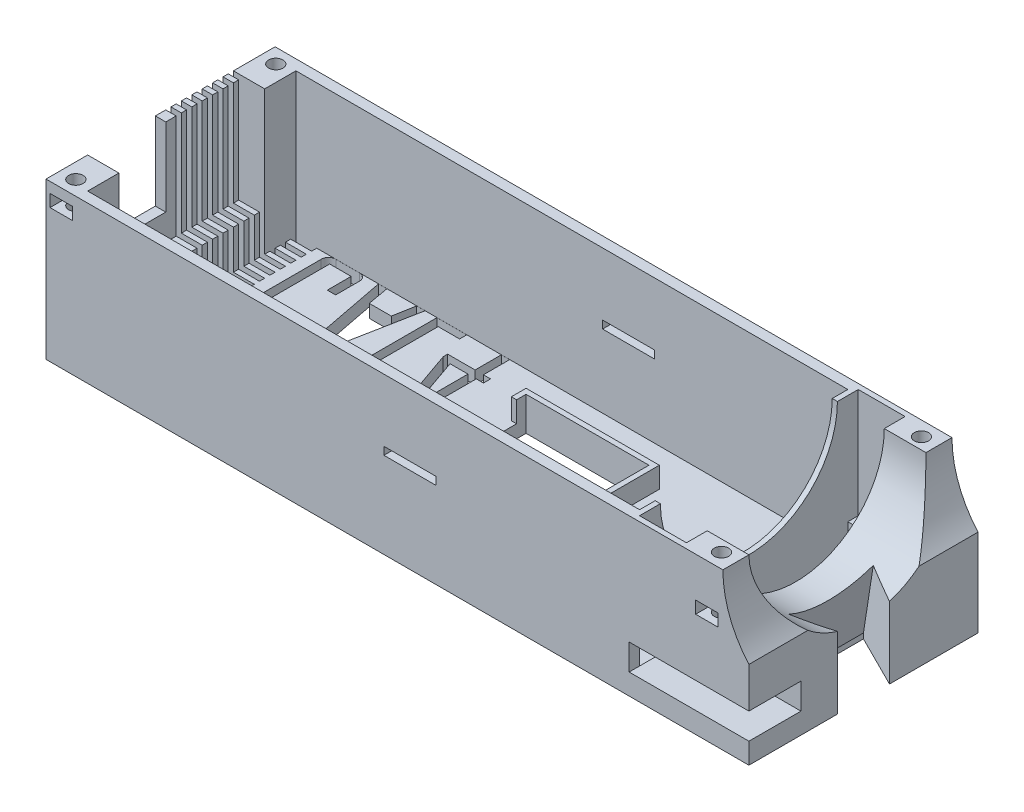
from build123d import *

# Parameters (mm, degrees)
SKETCH3_W               = 520.7
SKETCH3_H               = 111.76
BOSS_EXTRUDE1_DEPTH     = 73.66
SKETCH4_R               = 50.8
CUT_EXTRUDE2_DEPTH      = 156.718
SKETCH2_W               = 6.604
SKETCH2_H               = 8.636
SKETCH2_W_2             = 71.755
SKETCH2_H_2             = 71.755
SKETCH2_R               = 29.21
SKETCH2_R_2             = 20.32
CUT_EXTRUDE5_DEPTH      = 96.52
BOSS_EXTRUDE2_DEPTH     = 96.52
SKETCH5_R               = 43.18
CUT_EXTRUDE3_DEPTH      = 304.8
SKETCH6_W               = 279.4
SKETCH6_H               = 101.6
CUT_EXTRUDE4_DEPTH      = 50.8
BOSS_EXTRUDE3_DEPTH     = 2.54
SKETCH10_W              = 2.54
SKETCH10_H              = 101.6
SKETCH10_W_2            = 45.389856448
SKETCH10_H_2            = 38.1
CUT_EXTRUDE6_DEPTH      = 25.4
CUT_EXTRUDE7_DEPTH      = 50.8
BOSS_EXTRUDE4_START     = -76.2
SKETCH13_W              = 15.24
SKETCH13_H              = 20.32
BOSS_EXTRUDE4_DEPTH     = 76.2
SKETCH14_W              = 11
SKETCH14_H              = 6
CUT_EXTRUDE8_DEPTH      = 14
CUT_EXTRUDE9_DEPTH      = 406.4
CUT_EXTRUDE9_DEPTH_BACK = 5.08
SKETCH15_R              = 3.5
CUT_EXTRUDE10_START     = -111.76
SKETCH14_2_W            = 11
SKETCH14_2_H            = 6
CUT_EXTRUDE10_DEPTH     = 14
SKETCH18_W              = 269.24
SKETCH18_H              = 101.6
CUT_EXTRUDE12_DEPTH     = 19.05
CUT_EXTRUDE13_DEPTH     = 20.32
SKETCH20_W              = 59.944
SKETCH20_H              = 59.944
CUT_EXTRUDE14_DEPTH     = 73
SKETCH21_W              = 65.024
SKETCH21_H              = 65.024
SKETCH21_W_2            = 59.944
SKETCH21_H_2            = 59.944
BOSS_EXTRUDE5_DEPTH     = 10.16
SKETCH22_W              = 20.87594444
SKETCH22_H              = 50.707929828
CUT_EXTRUDE15_DEPTH     = 10.16
SKETCH23_W              = 25.4
SKETCH23_H              = 3.81
CUT_EXTRUDE16_DEPTH     = 187.96
SKETCH24_W              = 35.579541651
SKETCH24_H              = 12.7
CUT_EXTRUDE17_DEPTH     = 58.42
SKETCH25_W              = 22.86
SKETCH25_H              = 106.68
CUT_EXTRUDE18_DEPTH     = 53.34
SKETCH26_W              = 22.86
SKETCH26_H              = 25.4
CUT_EXTRUDE19_DEPTH     = 52.54
SKETCH27_W              = 22.86
SKETCH27_H              = 73.66
CUT_EXTRUDE20_DEPTH     = 15.24


with BuildPart() as part:
    # Sketch3 → Boss-Extrude1 (new body)
    with BuildSketch(Plane(origin=(0, 0, 0), x_dir=(1, 0, 0), z_dir=(0, 1, 0))):
        with Locations((209.55, 36.195)):
            Rectangle(SKETCH3_W, SKETCH3_H)
    extrude(amount=BOSS_EXTRUDE1_DEPTH)

    # Sketch4 → Cut-Extrude2 (cut)
    with BuildSketch(Plane.XY.offset(19.685)):
        with Locations((330.2, 73.66)):
            Circle(SKETCH4_R)
        Polygon((469.9, 22.86), (330.2, 22.86), (279.4, 73.66), (469.9, 73.66), align=None)
    extrude(amount=-CUT_EXTRUDE2_DEPTH, mode=Mode.SUBTRACT)

    # Sketch2 → Cut-Extrude5 (cut)
    # profile 1 of 9: a face of its own
    with BuildSketch(Plane(origin=(0, 0, 0), x_dir=(1, 0, 0), z_dir=(0, 1, 0))):
        Polygon((266.7, 10.795), (292.1, 23.495), (292.1, 48.895), (266.7, 61.595), align=None)
    # profile 2 of 9: a face of its own
    with BuildSketch(Plane(origin=(0, 0, 0), x_dir=(1, 0, 0), z_dir=(0, 1, 0))):
        Polygon((292.1, -19.685), (469.9, -19.685), (469.9, 92.075), (292.1, 92.075), (292.1, 48.895), (292.1, 23.495), align=None)
        Polygon((451.485, 74.93), (451.485, -2.54), (374.015, -2.54), (374.015, -0.635), (317.5, -0.635), (317.5, 48.895), (313.944, 48.895), (313.944, 68.453), (307.34, 68.453), (307.34, 77.089), (313.944, 77.089), (317.5, 77.089), (317.5, 89.789), (449.58, 89.789), (449.58, 74.93), align=None, mode=Mode.SUBTRACT)
    # profile 3 of 9: a face of its own
    with BuildSketch(Plane(origin=(0, 0, 0), x_dir=(1, 0, 0), z_dir=(0, 1, 0))):
        Polygon((326.263, 3.175), (374.015, 3.175), (374.015, 74.93), (445.77, 74.93), (445.77, 85.979), (326.263, 85.979), (326.263, 77.089), (326.263, 48.895), align=None)
    # profile 4 of 9: a face of its own
    with BuildSketch(Plane(origin=(0, 0, 0), x_dir=(1, 0, 0), z_dir=(0, 1, 0))):
        Polygon((317.5, -0.635), (374.015, -0.635), (374.015, 3.175), (326.263, 3.175), (326.263, 48.895), (317.5, 48.895), align=None)
    # profile 5 of 9: a face of its own
    with BuildSketch(Plane(origin=(0, 0, 0), x_dir=(1, 0, 0), z_dir=(0, 1, 0))):
        with Locations((310.642, 72.771)):
            Rectangle(SKETCH2_W, SKETCH2_H)
    # profile 6 of 9: a face of its own
    with BuildSketch(Plane(origin=(0, 0, 0), x_dir=(1, 0, 0), z_dir=(0, 1, 0))):
        Polygon((445.77, 74.93), (449.58, 74.93), (449.58, 89.789), (317.5, 89.789), (317.5, 77.089), (326.263, 77.089), (326.263, 85.979), (445.77, 85.979), align=None)
    # profile 7 of 9: a face of its own
    with BuildSketch(Plane(origin=(0, 0, 0), x_dir=(1, 0, 0), z_dir=(0, 1, 0))):
        with Locations((409.8925, 39.0525)):
            Rectangle(SKETCH2_W_2, SKETCH2_H_2)
        with Locations((412.75, 36.195)):
            Circle(SKETCH2_R, mode=Mode.SUBTRACT)
    # profile 8 of 9: a face of its own
    with BuildSketch(Plane(origin=(0, 0, 0), x_dir=(1, 0, 0), z_dir=(0, 1, 0))):
        with Locations((412.75, 36.195)):
            Circle(SKETCH2_R)
        with Locations((412.75, 36.195)):
            Circle(SKETCH2_R_2, mode=Mode.SUBTRACT)
    # profile 9 of 9: a face of its own
    with BuildSketch(Plane(origin=(0, 0, 0), x_dir=(1, 0, 0), z_dir=(0, 1, 0))):
        with Locations((412.75, 36.195)):
            Circle(SKETCH2_R_2)
    extrude(amount=CUT_EXTRUDE5_DEPTH, mode=Mode.SUBTRACT)


with BuildPart() as cut_extrude5_kept_piece:
    # of the separate pieces the step leaves, the one the design keeps (cut_extrude5_pieces_kept)
    add(part.part.solids().sort_by_distance((-50.8, 0, -92.075))[0])

    # Sketch8 → Boss-Extrude2 (add)
    with BuildSketch(Plane(origin=(0, 0, -92.075), x_dir=(-1, 0, 0), z_dir=(0, 0, -1))):
        Polygon((-266.7, 0), (-280.811202491, 52.663724651), (-120.77367767, 52.663724651), (-106.383256095, 52.663724651), (-106.383256095, 0), align=None)
    extrude(amount=-BOSS_EXTRUDE2_DEPTH)

    # Sketch5 → Cut-Extrude3 (cut)
    with BuildSketch(Plane(origin=(0, 0, 0), x_dir=(0, 0, -1), z_dir=(1, 0, 0))):
        with Locations((36.195, 73.66)):
            Circle(SKETCH5_R)
    extrude(amount=CUT_EXTRUDE3_DEPTH, mode=Mode.SUBTRACT)

    # Sketch6 → Cut-Extrude4 (cut)
    with BuildSketch(Plane(origin=(0, 73.66, 0), x_dir=(1, 0, 0), z_dir=(0, 1, 0))):
        with Locations((93.98, 36.195)):
            Rectangle(SKETCH6_W, SKETCH6_H)
    extrude(amount=-CUT_EXTRUDE4_DEPTH, mode=Mode.SUBTRACT)

    # Sketch7 → Cut-Revolve1 (revolve, cut)
    with BuildSketch(Plane(origin=(0, 73.66, 0), x_dir=(1, 0, 0), z_dir=(0, 1, 0))):
        with BuildLine():
            Line((241.3, -13.805), (245.161436971, -13.805))
            ThreePointArc((245.161436971, -13.805), (245.979341863, -10.401680901), (246.739500346, -6.985))
            Line((246.739500346, -6.985), (241.3, -6.985))
            Line((241.3, -6.985), (241.3, -13.805))
        make_face()
    revolve(axis=Axis((-45.72, 73.66, -36.195), (1, 0, 0)), mode=Mode.SUBTRACT)

    # Sketch2<11> → Boss-Extrude3 (add)
    with BuildSketch(Plane(origin=(0, 0, 0), x_dir=(1, 0, 0), z_dir=(0, 1, 0))):
        Polygon((-50.8, -19.685), (292.1, -19.685), (292.1, 23.495), (266.7, 10.795), (266.7, 61.595), (292.1, 48.895), (292.1, 92.075), (-50.8, 92.075), align=None)
    extrude(amount=-BOSS_EXTRUDE3_DEPTH)

    # Sketch10 → Cut-Extrude6 (cut)
    with BuildSketch(Plane.ZY.offset(50.8)):
        with Locations((-85.725, 35.56)):
            Rectangle(SKETCH10_W, SKETCH10_H)
        with Locations((-80.645, 35.56)):
            Rectangle(SKETCH10_W, SKETCH10_H)
        with Locations((-75.565, 35.56)):
            Rectangle(SKETCH10_W, SKETCH10_H)
        with Locations((-70.485, 35.56)):
            Rectangle(SKETCH10_W, SKETCH10_H)
        with Locations((-65.405, 35.56)):
            Rectangle(SKETCH10_W, SKETCH10_H)
        with Locations((-60.325, 35.56)):
            Rectangle(SKETCH10_W, SKETCH10_H)
        with Locations((-55.245, 35.56)):
            Rectangle(SKETCH10_W, SKETCH10_H)
        with Locations((-50.165, 35.56)):
            Rectangle(SKETCH10_W, SKETCH10_H)
        with Locations((-45.085, 35.56)):
            Rectangle(SKETCH10_W, SKETCH10_H)
        with Locations((-40.005, 35.56)):
            Rectangle(SKETCH10_W, SKETCH10_H)
        with Locations((-10.960071776, 54.61)):
            Rectangle(SKETCH10_W_2, SKETCH10_H_2)
    extrude(amount=-CUT_EXTRUDE6_DEPTH, mode=Mode.SUBTRACT)

    # Sketch11 → Cut-Extrude7 (cut)
    # profile 1 of 4: a face of its own
    with BuildSketch(Plane.XZ.offset(2.54)):
        with BuildLine():
            add(Edge.make_bspline(
                [(-1.033440652, -83.401170176), (-1.044005945, -83.654086912), (-1.064328213, -84.140570497), (-1.26755091, -84.829712357), (-1.575162908, -85.455903617), (-2.026585814, -85.985342425), (-2.561110938, -86.428572002), (-3.182622877, -86.740493137), (-3.869425011, -86.926834798), (-4.348309719, -86.950397605), (-4.594796073, -86.962525598)],
                knots=[0, 0, 0, 0, 1.072704838, 2.063340312, 3.030938541, 4.018639787, 4.998163091, 5.96576132, 6.952958679, 8, 8, 8, 8], degree=3))
            Line((-4.594796073, -86.962525598), (-16.07835029, -86.962525598))
            add(Edge.make_bspline(
                [(-16.07835029, -86.962525598), (-16.330932611, -86.950853548), (-16.815963405, -86.928439851), (-17.508859338, -86.740607294), (-18.129603023, -86.428109412), (-18.665521101, -85.988340987), (-19.105289526, -85.45242291), (-19.417787408, -84.831679225), (-19.605619965, -84.138783291), (-19.628033662, -83.653752498), (-19.639705712, -83.401170176)],
                knots=[0, 0, 0, 0, 1.070824542, 2.056291488, 3.022193657, 4, 4.977806343, 5.943708512, 6.929175458, 8, 8, 8, 8], degree=3))
            Line((-19.639705712, -83.401170176), (-19.639705712, -42.26388102))
            add(Edge.make_bspline(
                [(-19.639705712, -42.26388102), (-19.628076161, -42.011267067), (-19.605744076, -41.526175531), (-19.417340468, -40.833704624), (-19.107994595, -40.213510216), (-18.662543546, -39.684820027), (-18.127520948, -39.247535755), (-17.511427767, -38.922329382), (-16.815625708, -38.737298392), (-16.330816973, -38.714432915), (-16.07835029, -38.702525598)],
                knots=[0, 0, 0, 0, 1.071367344, 2.057333825, 3.023725611, 3.992084131, 4.970386125, 5.942666175, 6.928632656, 8, 8, 8, 8], degree=3))
            Line((-16.07835029, -38.702525598), (-4.594796073, -38.702525598))
            add(Edge.make_bspline(
                [(-4.594796073, -38.702525598), (-4.348421388, -38.714880572), (-3.869753637, -38.738884366), (-3.180053714, -38.922443683), (-2.563189657, -39.247063046), (-2.02953659, -39.687846108), (-1.572485586, -40.209995311), (-1.267998482, -40.835678862), (-1.064204252, -41.524386526), (-1.043963543, -42.010932072), (-1.033440652, -42.26388102)],
                knots=[0, 0, 0, 0, 1.047562091, 2.035250455, 3.009228488, 3.989238981, 4.967553953, 5.935633438, 6.926761628, 8, 8, 8, 8], degree=3))
            Line((-1.033440652, -42.26388102), (-1.033440652, -53.238670176))
            Line((-1.033440652, -53.238670176), (-5.103561134, -53.238670176))
            Line((-5.103561134, -53.238670176), (-5.103561134, -42.191200297))
            Line((-5.103561134, -42.191200297), (-15.56958523, -42.191200297))
            Line((-15.56958523, -42.191200297), (-15.56958523, -83.473850899))
            Line((-15.56958523, -83.473850899), (-5.103561134, -83.473850899))
            Line((-5.103561134, -83.473850899), (-5.103561134, -71.844935237))
            Line((-5.103561134, -71.844935237), (-1.033440652, -71.844935237))
            Line((-1.033440652, -71.844935237), (-1.033440652, -83.401170176))
        make_face()
    # profile 2 of 4: a face of its own
    with BuildSketch(Plane.XZ.offset(2.54)):
        Polygon((27.457402722, -86.962525598), (23.38728224, -86.962525598), (21.461243083, -76.496501502), (10.722666276, -76.496501502), (8.851137662, -86.962525598), (4.78101718, -86.962525598), (4.78101718, -86.835334333), (14.08414971, -38.702525598), (18.154270192, -38.702525598), align=None)
        Polygon((20.834371848, -73.007826803), (16.046529228, -46.515703309), (11.340452421, -73.007826803), align=None, mode=Mode.SUBTRACT)
    # profile 3 of 4: a face of its own
    with BuildSketch(Plane.XZ.offset(2.54)):
        Polygon((47.808005132, -86.962525598), (33.271860553, -86.962525598), (33.271860553, -38.702525598), (37.341981035, -38.702525598), (37.341981035, -83.473850899), (47.808005132, -83.473850899), align=None)
    # profile 4 of 4: a face of its own
    with BuildSketch(Plane.XZ.offset(2.54)):
        with BuildLine():
            Line((72.228728023, -74.170718369), (68.740053324, -74.170718369))
            Line((68.740053324, -74.170718369), (68.740053324, -86.962525598))
            Line((68.740053324, -86.962525598), (64.669932842, -86.962525598))
            Line((64.669932842, -86.962525598), (64.669932842, -74.170718369))
            Line((64.669932842, -74.170718369), (51.29667983, -74.170718369))
            Line((51.29667983, -74.170718369), (51.29667983, -71.990296683))
            Line((51.29667983, -71.990296683), (62.916510403, -38.702525598))
            Line((62.916510403, -38.702525598), (66.986630885, -38.702525598))
            add(Edge.make_bspline(
                [(66.986630885, -38.702525598), (66.986630885, -38.74795105), (66.986630885, -38.808518319), (66.986630885, -38.869085588), (66.986630885, -38.884227405)],
                knots=[0, 0, 0, 0, 1.5, 2, 2, 2, 2], degree=3))
            Line((66.986630885, -38.884227405), (55.948246095, -70.68204367))
            Line((55.948246095, -70.68204367), (64.669932842, -70.68204367))
            Line((64.669932842, -70.68204367), (64.669932842, -53.238670176))
            Line((64.669932842, -53.238670176), (68.740053324, -53.238670176))
            Line((68.740053324, -53.238670176), (68.740053324, -70.68204367))
            Line((68.740053324, -70.68204367), (72.228728023, -70.68204367))
            Line((72.228728023, -70.68204367), (72.228728023, -74.170718369))
        make_face()
    extrude(amount=-CUT_EXTRUDE7_DEPTH, mode=Mode.SUBTRACT)


with BuildPart() as cut_extrude7_piece_1:
    # of the separate pieces the step leaves, piece 1, a body of its own (cut_extrude7_pieces)
    add(cut_extrude5_kept_piece.part.solids().sort_by_distance((-50.8, 73.66, -92.075))[0])

    # Sketch13 → Boss-Extrude4 (add)
    with BuildSketch(Plane(origin=(0, 73.66, 0), x_dir=(1, 0, 0), z_dir=(0, 1, 0)).offset(BOSS_EXTRUDE4_START)):
        with Locations((-43.18, -9.525)):
            Rectangle(SKETCH13_W, SKETCH13_H)
        with Locations((-43.18, 81.915)):
            Rectangle(SKETCH13_W, SKETCH13_H)
    extrude(amount=BOSS_EXTRUDE4_DEPTH)

    # Sketch14 → Cut-Extrude8 (cut)
    with BuildSketch(Plane.XY.offset(19.685)):
        with Locations((-43.346, 65.58)):
            Rectangle(SKETCH14_W, SKETCH14_H)
        with Locations((271.614, 51.26)):
            Rectangle(SKETCH14_W, SKETCH14_H)
    extrude(amount=-CUT_EXTRUDE8_DEPTH, mode=Mode.SUBTRACT)

    # Sketch15 → Cut-Extrude9 (cut, two sides: drawn at the far end of the back side and taken through both)
    with BuildSketch(Plane(origin=(0, 48.26, 0), x_dir=(1, 0, 0), z_dir=(0, 1, 0)).offset(-CUT_EXTRUDE9_DEPTH_BACK)):
        with Locations(Location((271.614, -12.573, 0), (0, 0, 270))):
            Circle(SKETCH15_R)
        with Locations(Location((-43.346, -12.573, 0), (0, 0, 270))):
            Circle(SKETCH15_R)
        with Locations(Location((-43.346, 84.963, 0), (0, 0, 270))):
            Circle(SKETCH15_R)
        with Locations(Location((271.614, 84.963, 0), (0, 0, 270))):
            Circle(SKETCH15_R)
    extrude(amount=CUT_EXTRUDE9_DEPTH + CUT_EXTRUDE9_DEPTH_BACK, mode=Mode.SUBTRACT)

    # Sketch14<2> → Cut-Extrude10 (cut)
    with BuildSketch(Plane.XY.offset(19.685).offset(CUT_EXTRUDE10_START)):
        with Locations((-43.346, 65.58)):
            Rectangle(SKETCH14_2_W, SKETCH14_2_H)
        with Locations((271.614, 51.26)):
            Rectangle(SKETCH14_2_W, SKETCH14_2_H)
    extrude(amount=CUT_EXTRUDE10_DEPTH, mode=Mode.SUBTRACT)


with BuildPart() as cut_extrude7_piece_2:
    # of the separate pieces the step leaves, piece 2, a body of its own (cut_extrude7_pieces)
    add(cut_extrude5_kept_piece.part.solids().sort_by_distance((20.834371848, -2.54, -73.007826803))[0])


with BuildPart() as cut_extrude12_tool:
    # Sketch18 → Cut-Extrude12 (new body)
    with BuildSketch(Plane(origin=(0, 22.86, 0), x_dir=(1, 0, 0), z_dir=(0, 1, 0))):
        with Locations((99.06, 36.195)):
            Rectangle(SKETCH18_W, SKETCH18_H)
    extrude(amount=-CUT_EXTRUDE12_DEPTH)


with BuildPart() as cut_extrude7_piece_1_1:
    add(cut_extrude7_piece_1.part)

    # Cut-Extrude12: cut by cut_extrude12_tool
    add(cut_extrude12_tool.part, mode=Mode.SUBTRACT)

    # Sketch20 → Cut-Extrude14 (cut)
    with BuildSketch(Plane.XZ.offset(2.54)):
        with Locations((127.508, -36.195)):
            Rectangle(SKETCH20_W, SKETCH20_H)
    extrude(amount=-CUT_EXTRUDE14_DEPTH, mode=Mode.SUBTRACT)

    # Sketch21 → Boss-Extrude5 (add)
    with BuildSketch(Plane(origin=(0, 3.81, 0), x_dir=(1, 0, 0), z_dir=(0, 1, 0))):
        with Locations((127.508, 36.195)):
            Rectangle(SKETCH21_W, SKETCH21_H)
        with Locations((127.508, 36.195)):
            Rectangle(SKETCH21_W_2, SKETCH21_H_2, mode=Mode.SUBTRACT)
    extrude(amount=BOSS_EXTRUDE5_DEPTH)

    # Sketch22 → Cut-Extrude15 (cut)
    with BuildSketch(Plane(origin=(0, 13.97, 0), x_dir=(1, 0, 0), z_dir=(0, 1, 0))):
        with Locations((97.536, 36.195)):
            Rectangle(SKETCH22_W, SKETCH22_H)
    extrude(amount=-CUT_EXTRUDE15_DEPTH, mode=Mode.SUBTRACT)

    # Sketch23 → Cut-Extrude16 (cut)
    with BuildSketch(Plane.XY.offset(19.685)):
        with Locations((126.746, 41.275)):
            Rectangle(SKETCH23_W, SKETCH23_H)
    extrude(amount=-CUT_EXTRUDE16_DEPTH, mode=Mode.SUBTRACT)

    # Sketch24 → Cut-Extrude17 (cut)
    with BuildSketch(Plane(origin=(292.1, 0, 0), x_dir=(0, 0, -1), z_dir=(1, 0, 0))):
        with Locations((-12.074770826, 13.97)):
            Rectangle(SKETCH24_W, SKETCH24_H)
    extrude(amount=-CUT_EXTRUDE17_DEPTH, mode=Mode.SUBTRACT)

    # Sketch25 → Cut-Extrude18 (cut)
    with BuildSketch(Plane(origin=(0, 73.66, 0), x_dir=(1, 0, 0), z_dir=(0, 1, 0))):
        with Locations((247.65, 36.195)):
            Rectangle(SKETCH25_W, SKETCH25_H)
    extrude(amount=-CUT_EXTRUDE18_DEPTH, mode=Mode.SUBTRACT)

    # Sketch26 → Cut-Extrude19 (cut)
    with BuildSketch(Plane(origin=(0, 20.32, 0), x_dir=(1, 0, 0), z_dir=(0, 1, 0))):
        with Locations((247.65, 36.195)):
            Rectangle(SKETCH26_W, SKETCH26_H)
    extrude(amount=-CUT_EXTRUDE19_DEPTH, mode=Mode.SUBTRACT)

    # Sketch27 → Cut-Extrude20 (cut)
    with BuildSketch(Plane(origin=(0, 20.32, 0), x_dir=(1, 0, 0), z_dir=(0, 1, 0))):
        with Locations((247.65, 47.625)):
            Rectangle(SKETCH27_W, SKETCH27_H)
    extrude(amount=-CUT_EXTRUDE20_DEPTH, mode=Mode.SUBTRACT)


with BuildPart() as cut_extrude7_piece_2_1:
    add(cut_extrude7_piece_2.part)

    # Cut-Extrude12: cut by cut_extrude12_tool
    add(cut_extrude12_tool.part, mode=Mode.SUBTRACT)

    # Sketch19 → Cut-Extrude13 (cut)
    with BuildSketch(Plane(origin=(0, 3.81, 0), x_dir=(1, 0, 0), z_dir=(0, 1, 0))):
        Polygon((9.67087241, 73.683569228), (23.926573724, 73.683569228), (16.798723067, 40.213661794), align=None)
    extrude(amount=-CUT_EXTRUDE13_DEPTH, mode=Mode.SUBTRACT)


solid = cut_extrude7_piece_1_1.part
